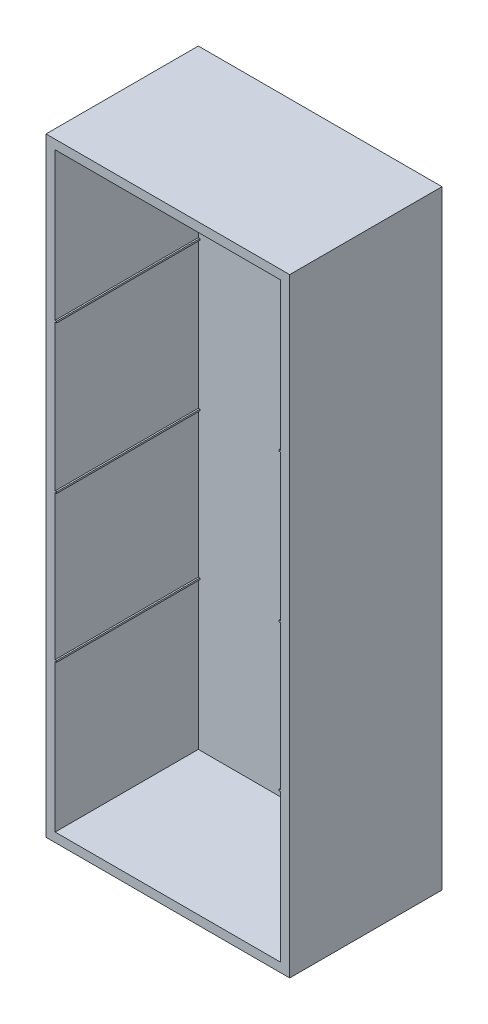
from build123d import *

# Parameters (mm, degrees)
SKETCH1_W           = 800
SKETCH1_H           = 2000
BOSS_EXTRUDE1_DEPTH = 500
SHELL2_T            = -30
SKETCH6_W           = 470
SKETCH6_H           = 5
BOSS_EXTRUDE2_DEPTH = 5
SKETCH8_W           = 470
SKETCH8_H           = 5
BOSS_EXTRUDE3_DEPTH = 5
SKETCH9_W           = 470
SKETCH9_H           = 5
BOSS_EXTRUDE4_DEPTH = 5
SKETCH11_W          = 470
SKETCH11_H          = 5
BOSS_EXTRUDE5_DEPTH = 5
SKETCH16_W          = 470
SKETCH16_H          = 5
BOSS_EXTRUDE6_DEPTH = 5
SKETCH17_W          = 470
SKETCH17_H          = 5
BOSS_EXTRUDE7_DEPTH = 5


with BuildPart() as part:
    # Sketch1 → Boss-Extrude1 (new body)
    with BuildSketch(Plane.XY):
        Rectangle(SKETCH1_W, SKETCH1_H)
    extrude(amount=BOSS_EXTRUDE1_DEPTH)

    # Shell2
    shell2_openings = [part.faces().sort_by_distance(p)[0] for p in [
        (0, 0, 500),
    ]]
    offset(amount=SHELL2_T, openings=shell2_openings, kind=Kind.INTERSECTION)

    # Sketch6 → Boss-Extrude2 (add)
    with BuildSketch(Plane.ZY.offset(-370)):
        with Locations((265, 482.5)):
            Rectangle(SKETCH6_W, SKETCH6_H)
    extrude(amount=BOSS_EXTRUDE2_DEPTH)

    # Sketch8 → Boss-Extrude3 (add)
    with BuildSketch(Plane(origin=(-370, 0, 0), x_dir=(0, 0, -1), z_dir=(1, 0, 0))):
        with Locations((-265, 482.5)):
            Rectangle(SKETCH8_W, SKETCH8_H)
    extrude(amount=BOSS_EXTRUDE3_DEPTH)

    # Sketch9 → Boss-Extrude4 (add)
    with BuildSketch(Plane.ZY.offset(-370)):
        with Locations((265, -2.5)):
            Rectangle(SKETCH9_W, SKETCH9_H)
    extrude(amount=BOSS_EXTRUDE4_DEPTH)

    # Sketch11 → Boss-Extrude5 (add)
    with BuildSketch(Plane(origin=(-370, 0, 0), x_dir=(0, 0, -1), z_dir=(1, 0, 0))):
        with Locations((-265, -2.5)):
            Rectangle(SKETCH11_W, SKETCH11_H)
    extrude(amount=BOSS_EXTRUDE5_DEPTH)

    # Sketch16 → Boss-Extrude6 (add)
    with BuildSketch(Plane.ZY.offset(-370)):
        with Locations((265, -482.5)):
            Rectangle(SKETCH16_W, SKETCH16_H)
    extrude(amount=BOSS_EXTRUDE6_DEPTH)

    # Sketch17 → Boss-Extrude7 (add)
    with BuildSketch(Plane(origin=(-370, 0, 0), x_dir=(0, 0, -1), z_dir=(1, 0, 0))):
        with Locations((-265, -482.5)):
            Rectangle(SKETCH17_W, SKETCH17_H)
    extrude(amount=BOSS_EXTRUDE7_DEPTH)


solid = part.part
